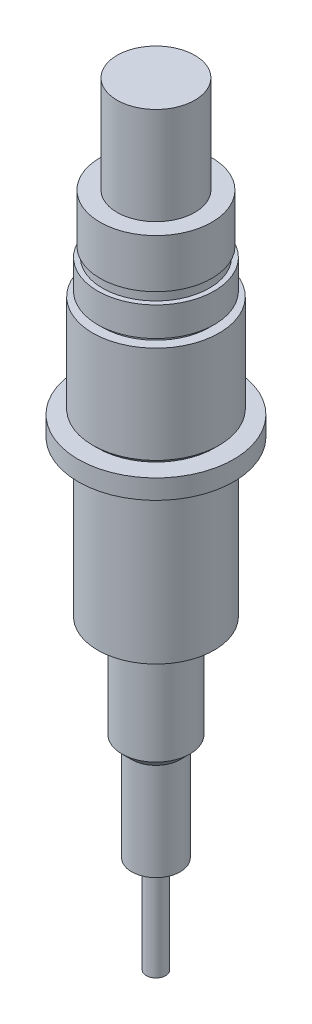
from build123d import *


with BuildPart() as part:
    # Sketch1 → Revolve1 (revolve)
    with BuildSketch(Plane(origin=(0, 0, 0), x_dir=(0, 0, -1), z_dir=(1, 0, 0)), mode=Mode.PRIVATE) as revolve1_sk:
        Polygon((0, 32), (0, -47.5), (1, -47.5), (1, -37.5), (2.5, -37.5), (2.5, -27.5), (3.5, -26.5), (3.5, -16.5), (3, -16.5), (3, -16), (6, -16), (6, -1), (5, 0), (8, 0), (8, 2), (6, 2), (6.5, 2.5), (6.5, 12.5), (5.5, 12.5), (5.5, 13), (6, 13), (6, 16), (5.5, 16), (5.5, 17), (5.75, 17), (5.75, 22), (4, 22), (4, 32), align=None)
    revolve(revolve1_sk.sketch.rotate(Axis((0, 32, 0), (0, -1, 0)), 180), axis=Axis((0, 32, 0), (0, -1, 0)))


solid = part.part
